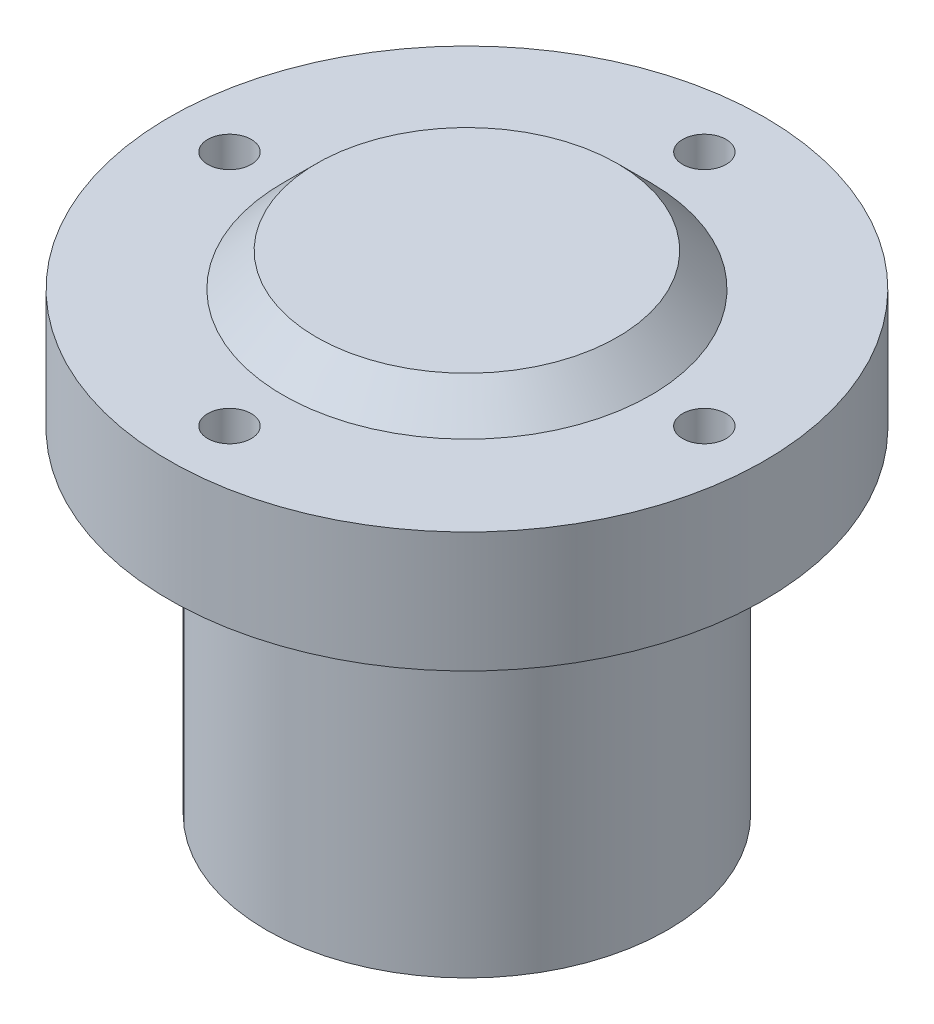
from build123d import *

# Parameters (mm, degrees)
SKETCH2_R          = 3.25
CUT_EXTRUDE1_DEPTH = 30


with BuildPart() as part:
    # Sketch1 → Revolve1 (revolve)
    with BuildSketch(Plane.XY, mode=Mode.PRIVATE) as revolve1_sk:
        Polygon((0, 73), (22.5, 73), (27.5, 68), (44.5, 68), (44.5, 50), (30, 50), (30, 0), (0, 0), align=None)
    revolve(revolve1_sk.sketch.rotate(Axis((0, 0, 0), (0, 1, 0)), 90), axis=Axis((0, 0, 0), (0, 1, 0)))

    # Sketch2 → Cut-Extrude1 (cut)
    with BuildSketch(Plane(origin=(0, 68, 0), x_dir=(1, 0, 0), z_dir=(0, 1, 0))):
        with Locations(Location((0, 35.5, 0), (0, 0, 270))):
            Circle(SKETCH2_R)
        with Locations(Location((35.5, 0, 0), (0, 0, 270))):
            Circle(SKETCH2_R)
        with Locations(Location((0, -35.5, 0), (0, 0, 270))):
            Circle(SKETCH2_R)
        with Locations(Location((-35.5, 0, 0), (0, 0, 270))):
            Circle(SKETCH2_R)
    extrude(amount=-CUT_EXTRUDE1_DEPTH, mode=Mode.SUBTRACT)


solid = part.part
